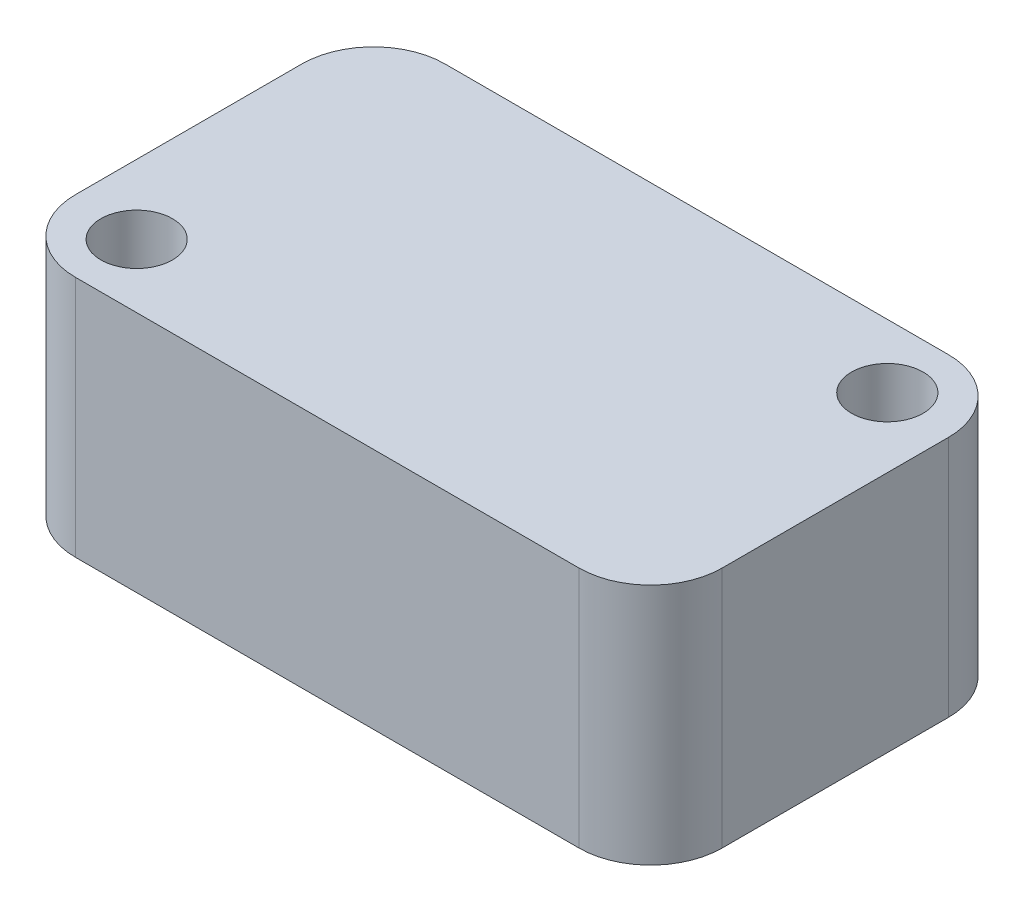
from build123d import *

# Parameters (mm, degrees)
SKETCH1_R           = 1.55
BOSS_EXTRUDE1_DEPTH = 10.5


with BuildPart() as part:
    # Sketch1 → Boss-Extrude1 (new body)
    with BuildSketch(Plane(origin=(0, 0, 0), x_dir=(1, 0, 0), z_dir=(0, 1, 0))):
        with BuildLine():
            Line((-10.9, -8), (10.9, -8))
            ThreePointArc((10.9, -8), (13.092031022, -7.092031022), (14, -4.9))
            Line((14, -4.9), (14, 4.9))
            ThreePointArc((14, 4.9), (13.092031022, 7.092031022), (10.9, 8))
            Line((10.9, 8), (-10.9, 8))
            ThreePointArc((-10.9, 8), (-13.092031022, 7.092031022), (-14, 4.9))
            Line((-14, 4.9), (-14, -4.9))
            ThreePointArc((-14, -4.9), (-13.092031022, -7.092031022), (-10.9, -8))
        make_face()
        with Locations(Location((11, 5.25, 0), (0, 0, 90))):
            Circle(SKETCH1_R, mode=Mode.SUBTRACT)
        with Locations(Location((-11, -5.25, 0), (0, 0, 90))):
            Circle(SKETCH1_R, mode=Mode.SUBTRACT)
    extrude(amount=BOSS_EXTRUDE1_DEPTH)


solid = part.part
